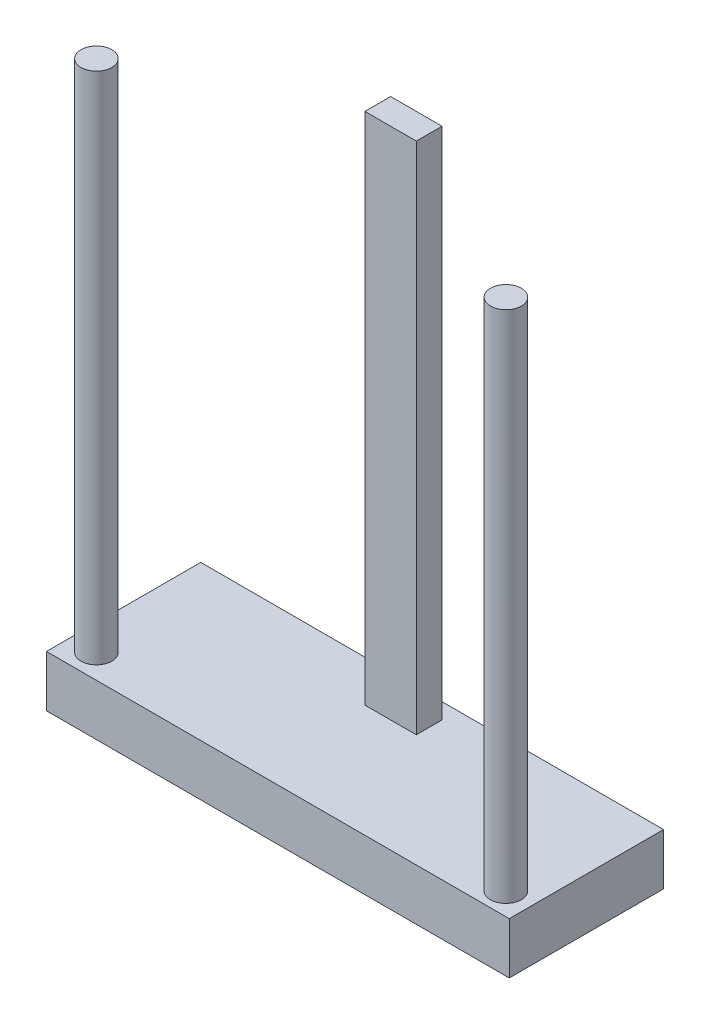
from build123d import *

# Parameters (mm, degrees)
SKETCH1_W           = 228.6
SKETCH1_H           = 76.2
BOSS_EXTRUDE1_DEPTH = 25.4
SKETCH2_R           = 7.62
SKETCH2_W           = 25.4
SKETCH2_H           = 12.7
BOSS_EXTRUDE2_DEPTH = 254


with BuildPart() as part:
    # Sketch1 → Boss-Extrude1 (new body)
    with BuildSketch(Plane(origin=(0, 0, 0), x_dir=(1, 0, 0), z_dir=(0, 1, 0))):
        with Locations((0, 26.13343465)):
            Rectangle(SKETCH1_W, SKETCH1_H)
    extrude(amount=BOSS_EXTRUDE1_DEPTH)

    # Sketch2 → Boss-Extrude2 (add)
    with BuildSketch(Plane(origin=(0, 25.4, 0), x_dir=(1, 0, 0), z_dir=(0, 1, 0))):
        with Locations(Location((-101.6, 0, 0), (0, 0, 90))):
            Circle(SKETCH2_R)
        with Locations(Location((101.6, -0.915640228, 0), (0, 0, 90))):
            Circle(SKETCH2_R)
        with Locations((0, 50.068949407)):
            Rectangle(SKETCH2_W, SKETCH2_H)
    extrude(amount=BOSS_EXTRUDE2_DEPTH)


solid = part.part
